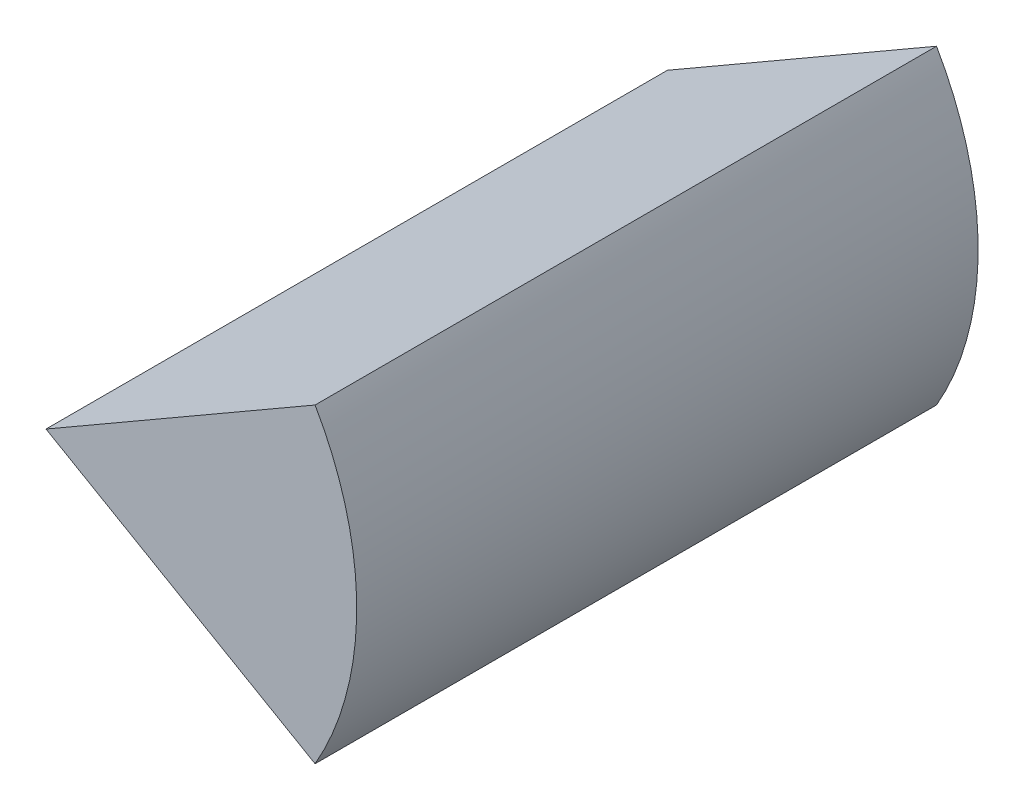
from build123d import *

# Parameters (mm, degrees)
SALIENTE_EXTRUIR1_DEPTH = 50
CROQUIS2_R              = 5
CORTAR_EXTRUIR1_DEPTH   = 10


with BuildPart() as part:
    # Croquis1 → Saliente-Extruir1 (new body)
    with BuildSketch(Plane.XY):
        with BuildLine():
            Line((0, 0), (21.650635095, 12.5))
            ThreePointArc((21.650635095, 12.5), (25, 0), (21.650635095, -12.5))
            Line((21.650635095, -12.5), (0, 0))
        make_face()
    extrude(amount=SALIENTE_EXTRUIR1_DEPTH)

    # Croquis2 → Cortar-Extruir1 (cut)
    with BuildSketch(Plane(origin=(0, 0, 0), x_dir=(-1, 0, 0), z_dir=(0, 0, -1))):
        with Locations((-15.921182133, 0.366074021)):
            Circle(CROQUIS2_R)
    extrude(amount=-CORTAR_EXTRUIR1_DEPTH, mode=Mode.SUBTRACT)


solid = part.part
